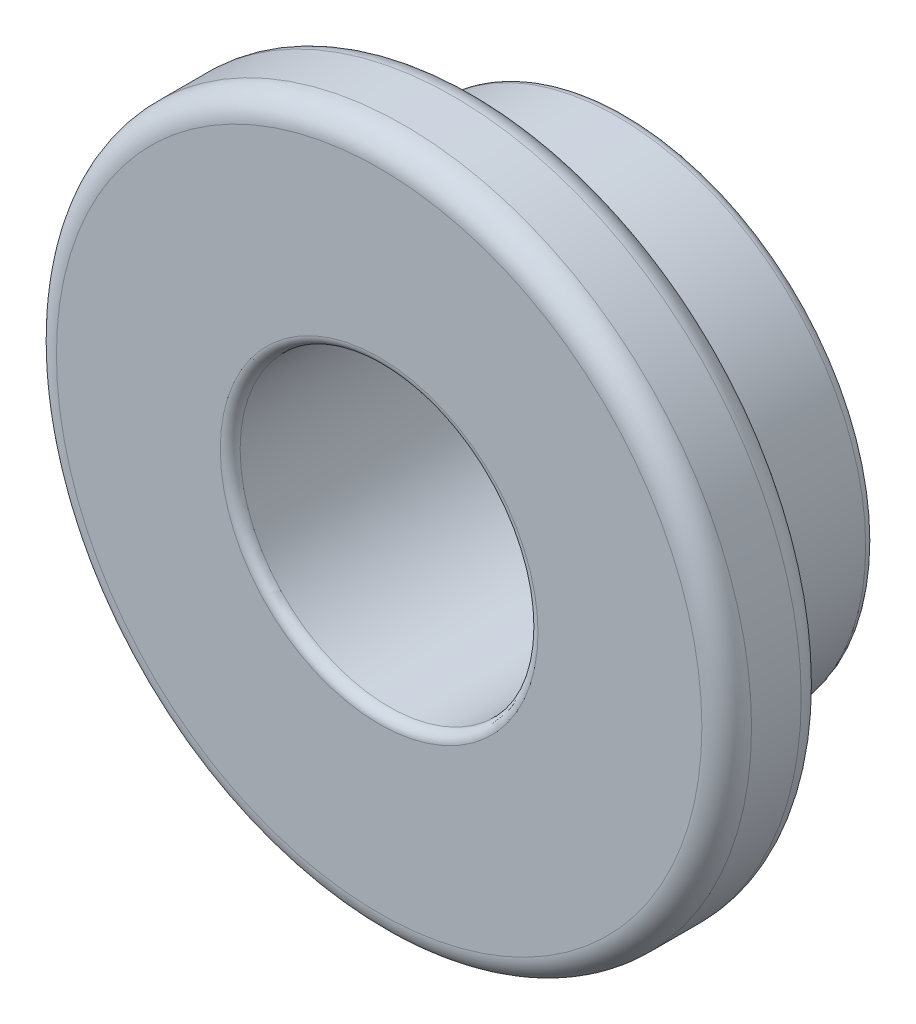
from build123d import *

# Parameters (mm, degrees)
SKETCH_2_R                = 7
EXTRUDE_1_DEPTH           = 2
SKETCH_3_R                = 5
EXTRUDE_2_DEPTH           = 5
HOLE_WIZARD_6_0_6_1_D     = 6
HOLE_WIZARD_6_0_6_1_DEPTH = 30.32
HOLE_WIZARD_6_0_6_1_TIP   = 1.802581857
FILLET_1_R                = 0.5
FILLET_2_R                = 0.2


with BuildPart() as part:
    # 草图2 → 凸台-拉伸1 (new body)
    with BuildSketch(Plane.XY):
        Circle(SKETCH_2_R)
    extrude(amount=EXTRUDE_1_DEPTH)

    # 草图3 → 凸台-拉伸2 (add)
    with BuildSketch(Plane.XY.offset(2)):
        Circle(SKETCH_3_R)
    extrude(amount=-EXTRUDE_2_DEPTH)

    # Ø6.0 (6) 直径孔1
    with Locations(Plane.XY.offset(2)):
        with Locations((0, 0)):
            Hole(HOLE_WIZARD_6_0_6_1_D / 2, depth=HOLE_WIZARD_6_0_6_1_DEPTH)
            with Locations((0, 0, -(HOLE_WIZARD_6_0_6_1_DEPTH + HOLE_WIZARD_6_0_6_1_TIP / 2))):  # 118° drill point
                Cone(0, HOLE_WIZARD_6_0_6_1_D / 2, HOLE_WIZARD_6_0_6_1_TIP, mode=Mode.SUBTRACT)

    # 圆角1
    fillet_1_edges = [part.edges().sort_by_distance(p)[0] for p in [
        (-7, 0, 0),
        (-7, 0, 2),
    ]]
    fillet(fillet_1_edges, radius=FILLET_1_R)

    # 圆角2
    fillet_2_edges = [part.edges().sort_by_distance(p)[0] for p in [
        (3, 0, -3),
        (3, 0, 2),
        (-5, 0, -3),
    ]]
    fillet(fillet_2_edges, radius=FILLET_2_R)


solid = part.part
